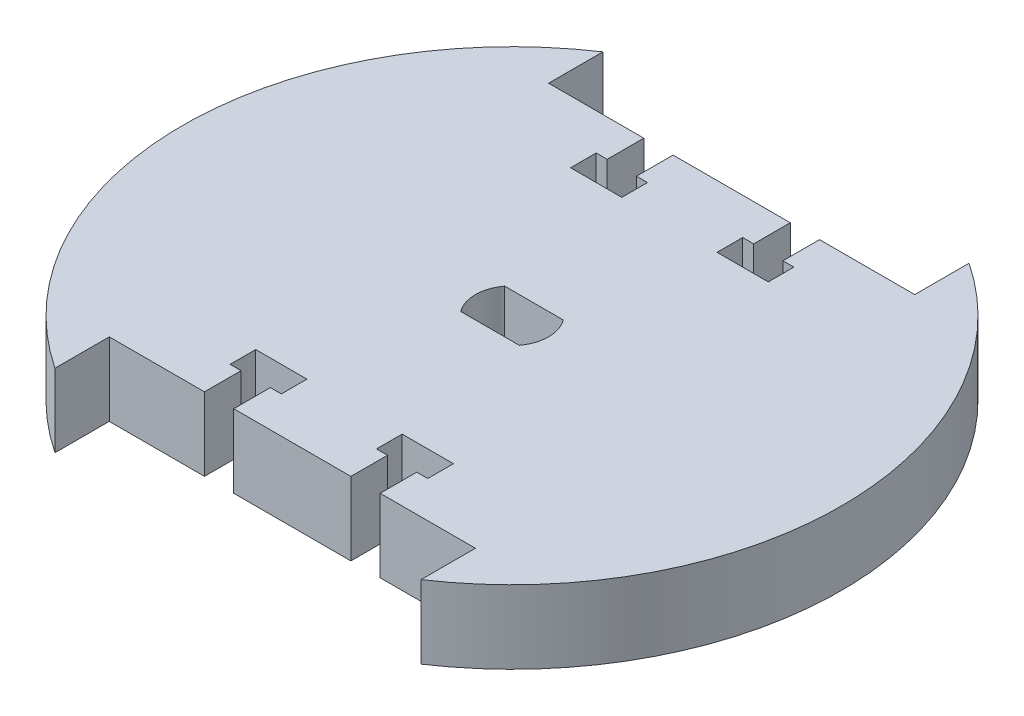
from build123d import *

# Parameters (mm, degrees)
ESTRUSIONE_ESTRUSIONE1_DEPTH = 10
SCHIZZO3_W                   = 8
SCHIZZO3_H                   = 6
TAGLIO_ESTRUSIONE2_DEPTH     = 60.371710435
TAGLIO_ESTRUSIONE3_DEPTH     = 60.371710435


with BuildPart() as part:
    # Schizzo1 → Estrusione-Estrusione1 (new body)
    with BuildSketch(Plane(origin=(0, 0, 0), x_dir=(1, 0, 0), z_dir=(0, 1, 0))):
        with BuildLine():
            Line((-25, 37.416573868), (-25, 30))
            Line((-25, 30), (25, 30))
            Line((25, 30), (25, 37.416573868))
            ThreePointArc((25, 37.416573868), (45, 0), (25, -37.416573868))
            Line((25, -37.416573868), (25, -30))
            Line((25, -30), (-25, -30))
            Line((-25, -30), (-25, -37.416573868))
            ThreePointArc((-25, -37.416573868), (-45, 0), (-25, 37.416573868))
        make_face()
    extrude(amount=ESTRUSIONE_ESTRUSIONE1_DEPTH)

    # Schizzo3 → Taglio-Estrusione2 (cut, through all)
    with BuildSketch(Plane(origin=(0, 10, 0), x_dir=(1, 0, 0), z_dir=(0, 1, 0))):
        with BuildLine():
            Line((-4, -3), (-4, 3))
            ThreePointArc((-4, 3), (-5, 0), (-4, -3))
        make_face()
        Rectangle(SCHIZZO3_W, SCHIZZO3_H)
        with BuildLine():
            ThreePointArc((5, 0), (4.74341649, 1.58113883), (4, 3))
            Line((4, 3), (4, -3))
            ThreePointArc((4, -3), (4.74341649, -1.58113883), (5, 0))
        make_face()
    extrude(amount=-TAGLIO_ESTRUSIONE2_DEPTH, mode=Mode.SUBTRACT)

    # Schizzo5 → Taglio-Estrusione3 (cut, through all)
    with BuildSketch(Plane(origin=(0, 10, 0), x_dir=(1, 0, 0), z_dir=(0, 1, 0))):
        Polygon((8, -25), (8, -28.5), (8, -30), (12, -30), (12, -27), (12, -25), (13.5, -25), (13.5, -21.5), (6.5, -21.5), (6.5, -25), align=None)
        Polygon((-13.5, 21.5), (-6.5, 21.5), (-6.5, 25), (-8, 25), (-8, 28.5), (-8, 30), (-12, 30), (-12, 28.5), (-12, 25), (-13.5, 25), align=None)
        Polygon((6.5, 21.5), (13.5, 21.5), (13.5, 25), (12, 25), (12, 27), (12, 30), (8, 30), (8, 28.5), (8, 25), (6.5, 25), align=None)
        Polygon((-8, -28.5), (-8, -25), (-6.5, -25), (-6.5, -21.5), (-13.5, -21.5), (-13.5, -25), (-12, -25), (-12, -28.5), (-12, -30), (-8, -30), align=None)
    extrude(amount=-TAGLIO_ESTRUSIONE3_DEPTH, mode=Mode.SUBTRACT)


solid = part.part
